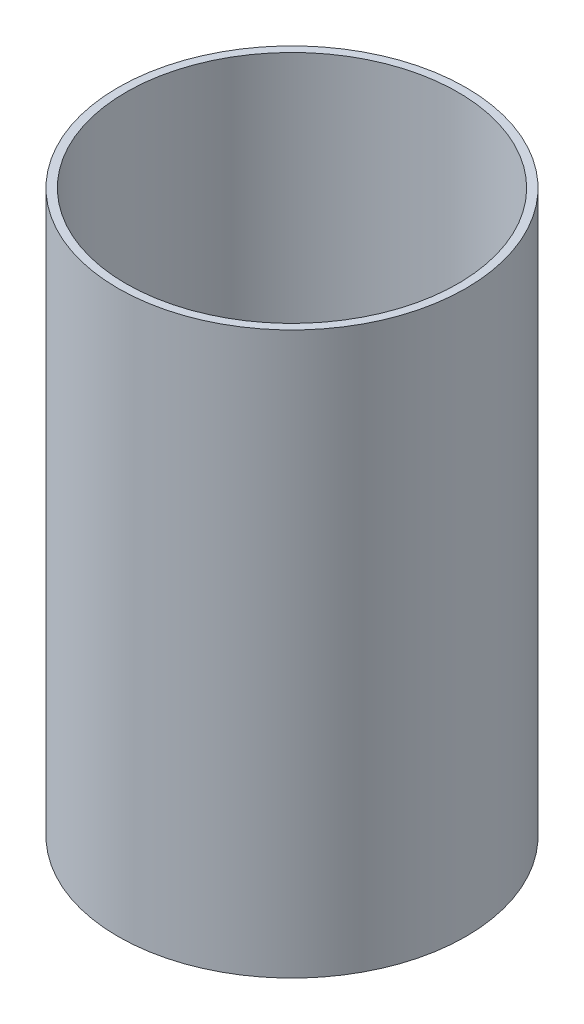
from build123d import *

# Parameters (mm, degrees)
SKETCH1_R           = 109.9312
SKETCH1_R_2         = 104.8512
BOSS_EXTRUDE1_DEPTH = 354.6856


with BuildPart() as part:
    # Sketch1 → Boss-Extrude1 (new body)
    with BuildSketch(Plane(origin=(0, 0, 0), x_dir=(1, 0, 0), z_dir=(0, 1, 0))):
        with Locations(Location((0, 0, 0), (0, 0, 270))):
            Circle(SKETCH1_R)
        with Locations(Location((0, 0, 0), (0, 0, 270))):
            Circle(SKETCH1_R_2, mode=Mode.SUBTRACT)
    extrude(amount=BOSS_EXTRUDE1_DEPTH)


solid = part.part
